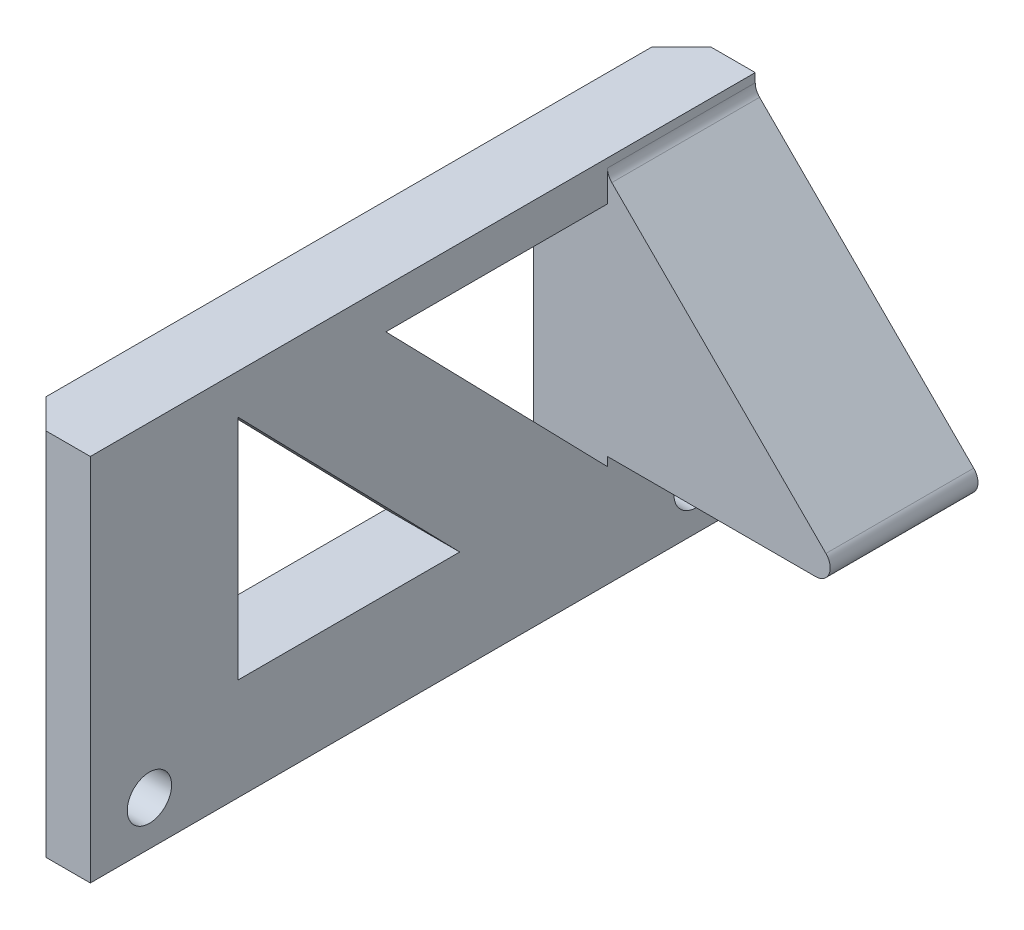
from build123d import *

# Parameters (mm, degrees)
SKETCH1_W           = 45
SKETCH1_H           = 25
BOSS_EXTRUDE1_DEPTH = 5
SKETCH2_R           = 1.5
CUT_EXTRUDE1_DEPTH  = 27.220221204
CUT_EXTRUDE2_DEPTH  = 27.220221204
CHAMFER2_SIZE       = 2
BOSS_EXTRUDE2_START = -10
BOSS_EXTRUDE2_DEPTH = 10
FILLET1_R           = 1


with BuildPart() as part:
    # Sketch1 → Boss-Extrude1 (new body)
    with BuildSketch(Plane(origin=(0, 0, 0), x_dir=(0, 0, -1), z_dir=(1, 0, 0))):
        Rectangle(SKETCH1_W, SKETCH1_H)
    extrude(amount=BOSS_EXTRUDE1_DEPTH)

    # Sketch2 → Cut-Extrude1 (cut, through all)
    with BuildSketch(Plane(origin=(5, 0, 0), x_dir=(0, 0, -1), z_dir=(1, 0, 0))):
        with Locations((-18.5, -9.5)):
            Circle(SKETCH2_R)
        with Locations((18.5, -9.5)):
            Circle(SKETCH2_R)
    extrude(amount=-CUT_EXTRUDE1_DEPTH, mode=Mode.SUBTRACT)

    # Sketch3 → Cut-Extrude2 (cut, through all)
    with BuildSketch(Plane(origin=(5, 0, 0), x_dir=(0, 0, -1), z_dir=(1, 0, 0))):
        Polygon((-12.5, 9.80361421), (-12.5, -5.599476508), (2.5, -5.599476508), align=None)
        Polygon((-2.5, 9.80361421), (12.5, 9.80361421), (12.5, -5.599476508), align=None)
    extrude(amount=-CUT_EXTRUDE2_DEPTH, mode=Mode.SUBTRACT)

    # Chamfer2
    chamfer2_edges = [part.edges().sort_by_distance(p)[0] for p in [
        (0, 0, 22.5),
        (0, 0, -22.5),
    ]]
    chamfer(chamfer2_edges, length=CHAMFER2_SIZE)

    # Sketch4 → Boss-Extrude2 (add)
    with BuildSketch(Plane(origin=(0, 0, -22.5), x_dir=(-1, 0, 0), z_dir=(0, 0, -1)).offset(BOSS_EXTRUDE2_START)):
        Polygon((-5, -5), (-21.490292585, -5), (-5, 11.490292585), align=None)
    extrude(amount=BOSS_EXTRUDE2_DEPTH)

    # Fillet1
    fillet1_edges = [part.edges().sort_by_distance(p)[0] for p in [
        (5, 11.490292585, -17.5),
        (21.490292585, -5, -17.5),
    ]]
    fillet(fillet1_edges, radius=FILLET1_R)


solid = part.part
